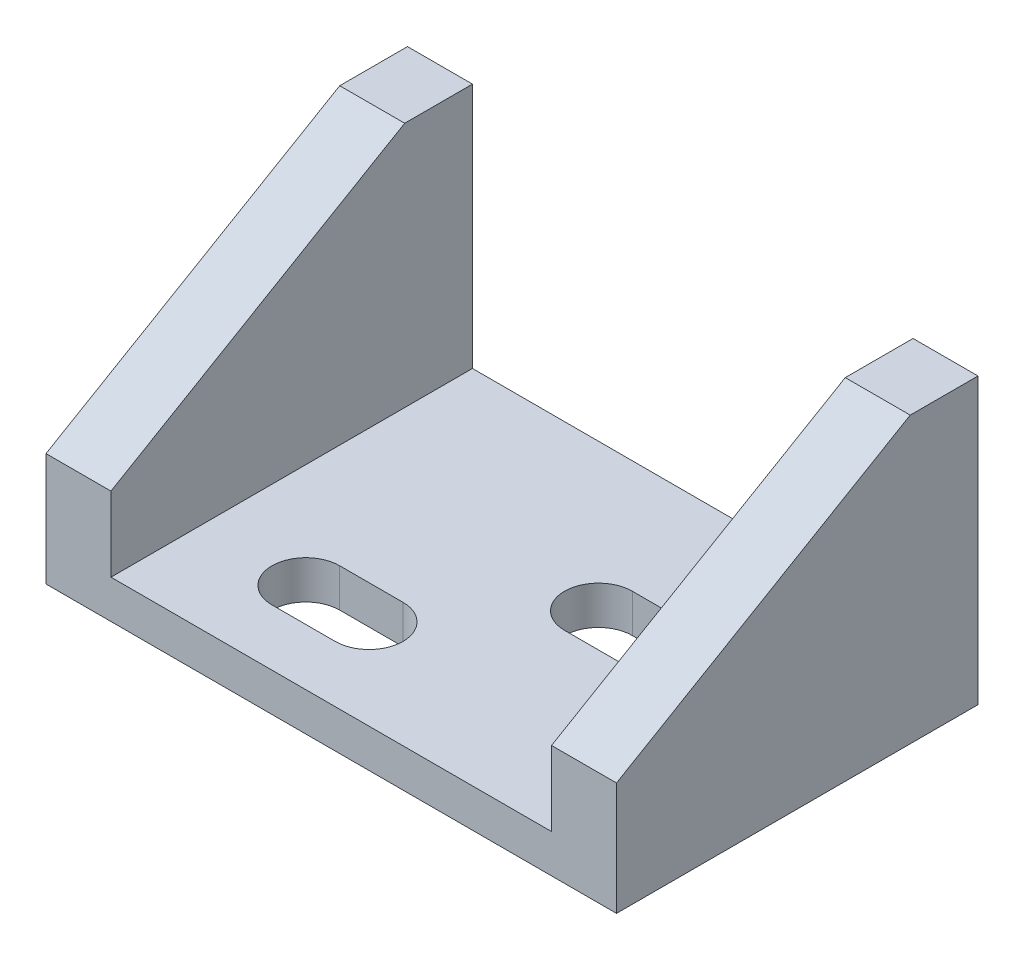
from build123d import *

# Parameters (mm, degrees)
SKETCH1_W           = 25.25
SKETCH1_H           = 16
BOSS_EXTRUDE1_DEPTH = 1.7
BOSS_EXTRUDE3_DEPTH = 12.625
CUT_EXTRUDE7_DEPTH  = 9.75
CUT_EXTRUDE8_REACH  = 21.549


with BuildPart() as part:
    # Sketch1 → Boss-Extrude1 (new body)
    with BuildSketch(Plane(origin=(0, 0, 0), x_dir=(1, 0, 0), z_dir=(0, 1, 0))):
        Rectangle(SKETCH1_W, SKETCH1_H)
    extrude(amount=BOSS_EXTRUDE1_DEPTH)

    # Sketch5 → Boss-Extrude3 (add, symmetric)
    with BuildSketch(Plane(origin=(0, 0, 0), x_dir=(0, 0, -1), z_dir=(1, 0, 0))):
        Polygon((-8, 1.7), (8, 1.7), (8, 12.6), (5, 12.6), (-8, 5), align=None)
    extrude(amount=BOSS_EXTRUDE3_DEPTH, both=True)

    # Sketch5<2> → Cut-Extrude7 (cut, symmetric)
    with BuildSketch(Plane(origin=(0, 0, 0), x_dir=(0, 0, -1), z_dir=(1, 0, 0))):
        Polygon((-8, 1.7), (8, 1.7), (8, 12.6), (5, 12.6), (-8, 5), align=None)
    extrude(amount=CUT_EXTRUDE7_DEPTH, both=True, mode=Mode.SUBTRACT)

    # Sketch6 → Cut-Extrude8 (cut, up to next)
    with BuildSketch(Plane(origin=(0, 0, 0), x_dir=(1, 0, 0), z_dir=(0, 1, 0)), mode=Mode.PRIVATE) as cut_extrude8_sk1:
        with BuildLine():
            Line((-5.125, -2.5), (-2.325, -2.5))
            ThreePointArc((-2.325, -2.5), (-0.825, -4), (-2.325, -5.5))
            Line((-2.325, -5.5), (-5.125, -5.5))
            ThreePointArc((-5.125, -5.5), (-6.625, -4), (-5.125, -2.5))
        make_face()
    cut_extrude8_tool1 = extrude(cut_extrude8_sk1.sketch, amount=CUT_EXTRUDE8_REACH, mode=Mode.PRIVATE) & part.part
    # Sketch6 → Cut-Extrude8 (cut, up to next)
    with BuildSketch(Plane(origin=(0, 0, 0), x_dir=(1, 0, 0), z_dir=(0, 1, 0)), mode=Mode.PRIVATE) as cut_extrude8_sk2:
        with BuildLine():
            Line((2.325, 0), (5.125, 0))
            ThreePointArc((5.125, 0), (6.625, 1.5), (5.125, 3))
            Line((5.125, 3), (2.325, 3))
            ThreePointArc((2.325, 3), (0.825, 1.5), (2.325, 0))
        make_face()
    cut_extrude8_tool2 = extrude(cut_extrude8_sk2.sketch, amount=CUT_EXTRUDE8_REACH, mode=Mode.PRIVATE) & part.part
    add(cut_extrude8_tool1.solids().sort_by_distance((-3.725, 0, 4))[0], mode=Mode.SUBTRACT)
    add(cut_extrude8_tool2.solids().sort_by_distance((3.725, 0, -1.5))[0], mode=Mode.SUBTRACT)


solid = part.part
